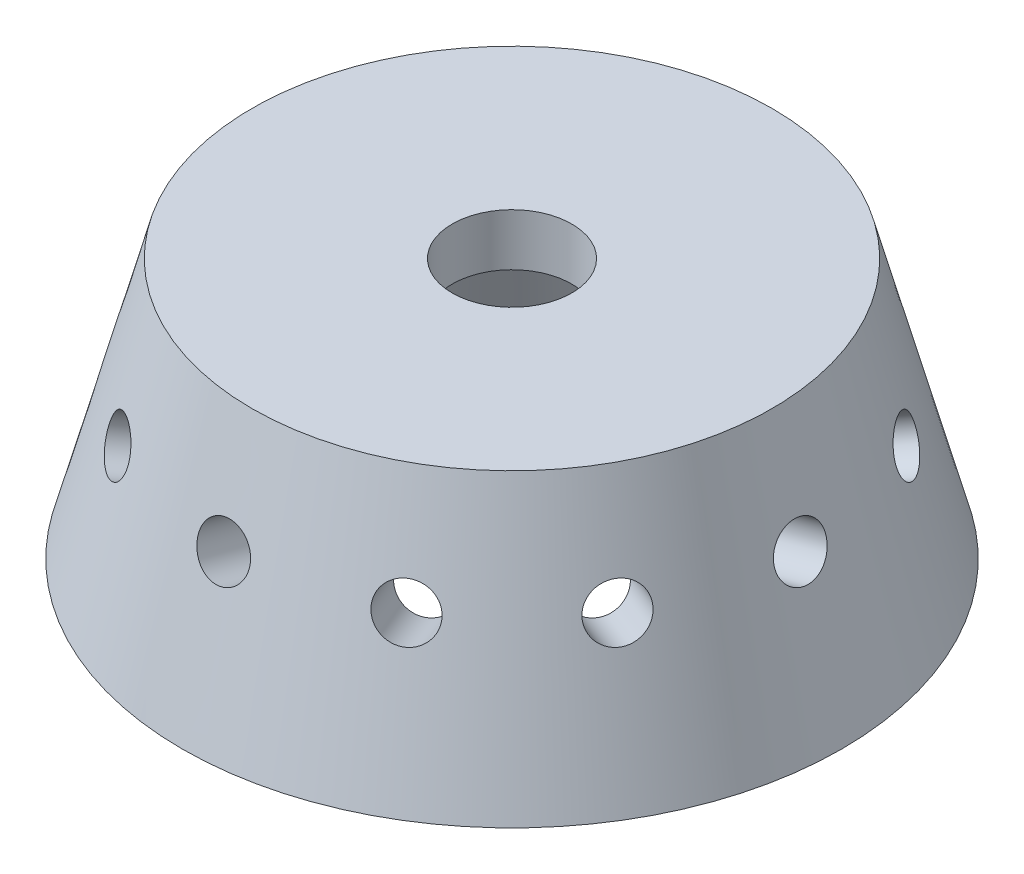
from build123d import *

# Parameters (mm, degrees)
SKETCH11_R         = 5.75
CUT_EXTRUDE1_DEPTH = 55.889298353
SKETCH24_R         = 2.5
CUT_EXTRUDE4_DEPTH = 10
CIRPATTERN1_COUNT  = 12
SKETCH25_R         = 40
CUT_EXTRUDE5_DEPTH = 5


with BuildPart() as part:
    # Sketch6 → Revolve2 (revolve)
    with BuildSketch(Plane.XY, mode=Mode.PRIVATE) as revolve2_sk:
        Polygon((32.502577388, -28), (25, 0), (0, 0), (0, -5), (20, -5), (26, -27.392304845), (0, -27.392304845), (0, -30), (32.502577388, -30), align=None)
    revolve(revolve2_sk.sketch.rotate(Axis((0, -5, 0), (0, 1, 0)), 90), axis=Axis((0, -5, 0), (0, 1, 0)))

    # Sketch11 → Cut-Extrude1 (cut, through all)
    with BuildSketch(Plane(origin=(0, 0, 0), x_dir=(1, 0, 0), z_dir=(0, 1, 0))):
        with Locations(Location((0, 0, 0), (0, 0, 270))):
            Circle(SKETCH11_R)
    extrude(amount=-CUT_EXTRUDE1_DEPTH, mode=Mode.SUBTRACT)

    # Sketch24 → Cut-Extrude4 (cut)
    with BuildSketch(Plane(origin=(23.325317547, 6.25, 1.655e-06), x_dir=(6.619825293528741e-08, 1.7737768391450607e-08, -0.9999999999999977), z_dir=(0.965925826289067, 0.2588190451025171, 6.853347444273516e-08))):
        with Locations(Location((1.655e-06, -17.340876022, 0), (0, 0, 351.234741954))):
            Circle(SKETCH24_R)
    cut_extrude4 = extrude(amount=-CUT_EXTRUDE4_DEPTH, mode=Mode.SUBTRACT)

    # CirPattern1: Cut-Extrude4 ×12 about axis
    cirpattern1_axis = Axis((0, -28, 0), (0, -1, 0))
    for i in range(1, CIRPATTERN1_COUNT):
        add(cut_extrude4.rotate(cirpattern1_axis, i * 360 / CIRPATTERN1_COUNT), mode=Mode.SUBTRACT)

    # Sketch25 → Cut-Extrude5 (cut)
    with BuildSketch(Plane.XZ.offset(30)):
        Circle(SKETCH25_R)
    extrude(amount=-CUT_EXTRUDE5_DEPTH, mode=Mode.SUBTRACT)


solid = part.part
